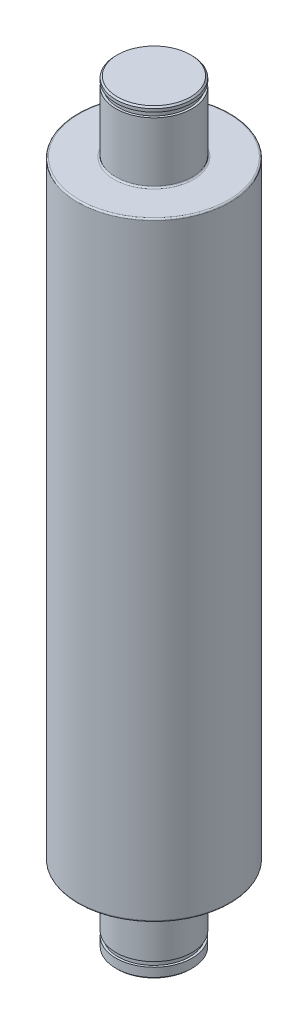
from build123d import *

# Parameters (mm, degrees)
ESQUISSE1_R             = 50
BOSS_EXTRU_1_DEPTH      = 400
ESQUISSE2_R             = 25
BOSS_EXTRU_2_DEPTH      = 46
BOSS_EXTRU_3_START      = 50
ESQUISSE3_R             = 25
BOSS_EXTRU_3_DEPTH      = 50
CONG_1_R                = 1
ENL_V_START             = -6.2
ESQUISSE4_R             = 25
ESQUISSE4_R_2           = 23.5
ENL_V_MAT_EXTRU_1_DEPTH = 3.2
ESQUISSE6_W             = 5.249523393
ESQUISSE6_H             = 3.2
CHANFREIN1_SIZE         = 1
ESQUISSE7_R             = 13
ENL_V_MAT_EXTRU_2_DEPTH = 40
ESQUISSE8_W             = 6
ESQUISSE8_H             = 5
ENL_V_MAT_EXTRU_3_DEPTH = 38


with BuildPart() as part:
    # Esquisse1 → Boss.-Extru.1 (new body)
    with BuildSketch(Plane(origin=(0, 0, 0), x_dir=(1, 0, 0), z_dir=(0, 1, 0))):
        with Locations(Location((0, 0, 0), (0, 0, 270))):
            Circle(ESQUISSE1_R)
    extrude(amount=BOSS_EXTRU_1_DEPTH)

    # Esquisse2 → Boss.-Extru.2 (add)
    with BuildSketch(Plane(origin=(0, 400, 0), x_dir=(1, 0, 0), z_dir=(0, 1, 0))):
        with Locations(Location((0, 0, 0), (0, 0, 270))):
            Circle(ESQUISSE2_R)
    extrude(amount=BOSS_EXTRU_2_DEPTH)

    # Esquisse3 → Boss.-Extru.3 (add)
    with BuildSketch(Plane.XZ.offset(BOSS_EXTRU_3_START)):
        with Locations(Location((0, 0, 0), (0, 0, 90))):
            Circle(ESQUISSE3_R)
    extrude(amount=-BOSS_EXTRU_3_DEPTH)

    # Congé1
    cong_1_edges = [part.edges().sort_by_distance(p)[0] for p in [
        (0, 0, -50),
        (0, 400, -50),
        (0, 400, -25),
        (0, 0, -25),
    ]]
    fillet(cong_1_edges, radius=CONG_1_R)

    # Esquisse4 → Enlèv. mat.-Extru.1 (cut)
    with BuildSketch(Plane(origin=(0, 446, 0), x_dir=(1, 0, 0), z_dir=(0, 1, 0)).offset(ENL_V_START)):
        with Locations(Location((0, 0, 0), (0, 0, 270))):
            Circle(ESQUISSE4_R)
        with Locations(Location((0, 0, 0), (0, 0, 270))):
            Circle(ESQUISSE4_R_2, mode=Mode.SUBTRACT)
    extrude(amount=ENL_V_MAT_EXTRU_1_DEPTH, mode=Mode.SUBTRACT)

    # Esquisse6 → Enlèvement de matière-Révolution1 (revolve, cut)
    with BuildSketch(Plane.XY, mode=Mode.PRIVATE) as enl_vement_de_mati_re_r_volution1_sk:
        with Locations((26.124761697, -41.6)):
            Rectangle(ESQUISSE6_W, ESQUISSE6_H)
    revolve(enl_vement_de_mati_re_r_volution1_sk.sketch.rotate(Axis((0, -50, 0), (0, 1, 0)), 90), axis=Axis((0, -50, 0), (0, 1, 0)), mode=Mode.SUBTRACT)

    # Chanfrein1
    chanfrein1_edges = [part.edges().sort_by_distance(p)[0] for p in [
        (0, -50, -25),
        (0, 446, -25),
    ]]
    chamfer(chanfrein1_edges, length=CHANFREIN1_SIZE)

    # Esquisse7 → Enlèv. mat.-Extru.2 (cut)
    with BuildSketch(Plane.XZ.offset(50)):
        with Locations(Location((0, 0, 0), (0, 0, 270))):
            Circle(ESQUISSE7_R)
    extrude(amount=-ENL_V_MAT_EXTRU_2_DEPTH, mode=Mode.SUBTRACT)

    # Esquisse8 → Enlèv. mat.-Extru.3 (cut)
    with BuildSketch(Plane.XZ.offset(50)):
        with Locations((0, 12.5)):
            Rectangle(ESQUISSE8_W, ESQUISSE8_H)
    extrude(amount=-ENL_V_MAT_EXTRU_3_DEPTH, mode=Mode.SUBTRACT)


solid = part.part
